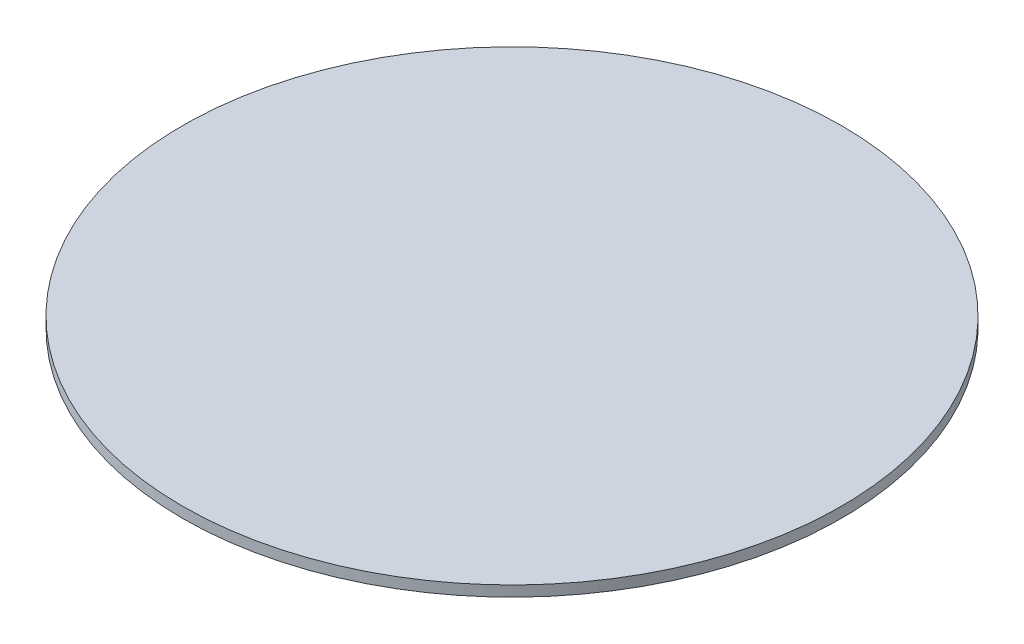
from build123d import *

# Parameters (mm, degrees)
SKETCH1_R           = 9.35
BOSS_EXTRUDE1_DEPTH = 0.3


with BuildPart() as part:
    # Sketch1 → Boss-Extrude1 (new body)
    with BuildSketch(Plane(origin=(0, 0, 0), x_dir=(1, 0, 0), z_dir=(0, 1, 0))):
        with Locations(Location((0, 0, 0), (0, 0, 270))):
            Circle(SKETCH1_R)
    extrude(amount=BOSS_EXTRUDE1_DEPTH)


solid = part.part
